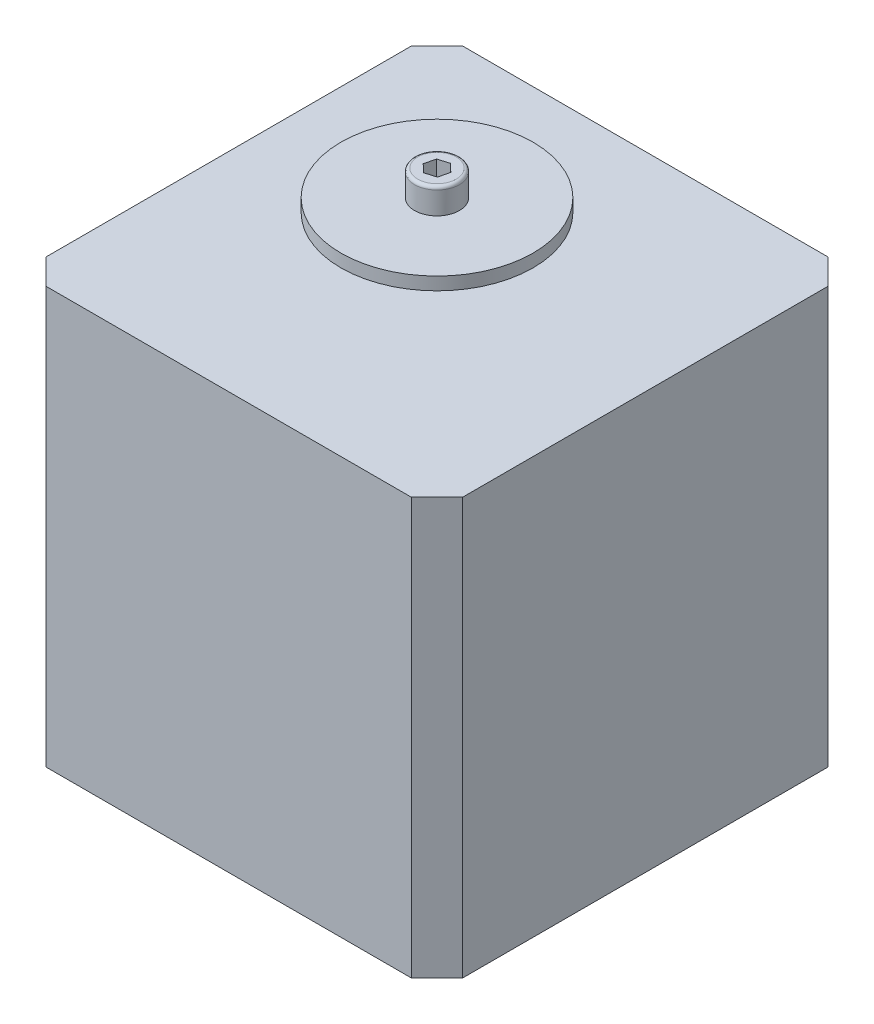
from build123d import *

# Parameters (mm, degrees)
ESQUISSE3_W             = 65
ESQUISSE3_H             = 65
BOSS_EXTRU_3_DEPTH      = 65
CHANFREIN1_SIZE         = 4
ENL_V_MAT_EXTRU_1_DEPTH = 2.5
CONG_1_R                = 0.5


with BuildPart() as part:
    # Esquisse3 → Boss.-Extru.3 (new body)
    with BuildSketch(Plane(origin=(0, 0, 0), x_dir=(1, 0, 0), z_dir=(0, 1, 0))):
        Rectangle(ESQUISSE3_W, ESQUISSE3_H)
    extrude(amount=BOSS_EXTRU_3_DEPTH)

    # Chanfrein1
    chanfrein1_edges = [part.edges().sort_by_distance(p)[0] for p in [
        (32.5, 32.5, 32.5),
        (-32.5, 32.5, 32.5),
        (-32.5, 32.5, -32.5),
        (32.5, 32.5, -32.5),
    ]]
    chamfer(chanfrein1_edges, length=CHANFREIN1_SIZE)


with BuildPart() as body_2:
    # Esquisse4 → Révolution1 (revolve)
    with BuildSketch(Plane.XY, mode=Mode.PRIVATE) as r_volution1_sk:
        Polygon((0, 65), (0, 79), (3.5, 79), (3.5, 75), (15, 75), (15, 73), (3, 73), (3, 65), align=None)
    revolve(r_volution1_sk.sketch.rotate(Axis((0, 79, 0), (0, 1, 0)), 90), axis=Axis((0, 79, 0), (0, 1, 0)))

    # Esquisse5 → Enlèv. mat.-Extru.1 (cut)
    with BuildSketch(Plane(origin=(0, 79, 0), x_dir=(1, 0, 0), z_dir=(0, 1, 0))):
        Polygon((1.262020142, -1.186298934), (1.658375084, 0.499792036), (0.396354942, 1.68609097), (-1.262020142, 1.186298934), (-1.658375084, -0.499792036), (-0.396354942, -1.68609097), align=None)
    extrude(amount=-ENL_V_MAT_EXTRU_1_DEPTH, mode=Mode.SUBTRACT)

    # Congé1
    cong_1_edges = [body_2.edges().sort_by_distance(p)[0] for p in [
        (0, 79, 3.5),
    ]]
    fillet(cong_1_edges, radius=CONG_1_R)


solid = Compound([part.part, body_2.part])
